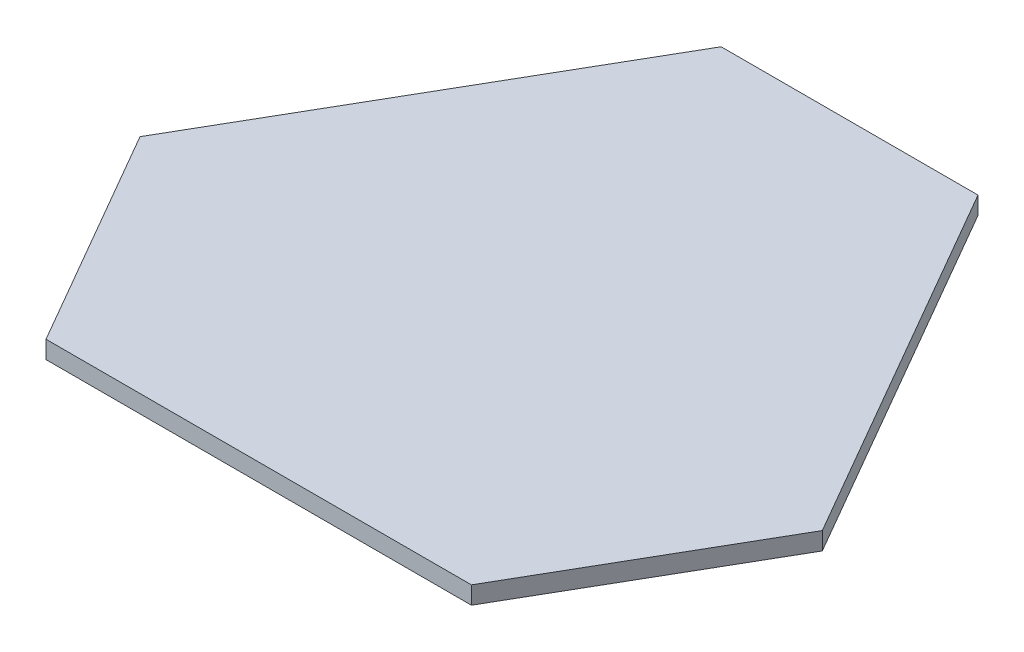
from build123d import *

# Parameters (mm, degrees)
BOSS_EXTRUDE1_DEPTH = 11


with BuildPart() as part:
    # Sketch1 → Boss-Extrude1 (new body)
    with BuildSketch(Plane(origin=(0, 0, 0), x_dir=(1, 0, 0), z_dir=(0, 1, 0))):
        Polygon((-80, 184.060796608), (80, 184.060796608), (212.5, -45.435935394), (132.5, -184), (-132.5, -184), (-212.5, -45.435935394), align=None)
    extrude(amount=BOSS_EXTRUDE1_DEPTH)


solid = part.part
